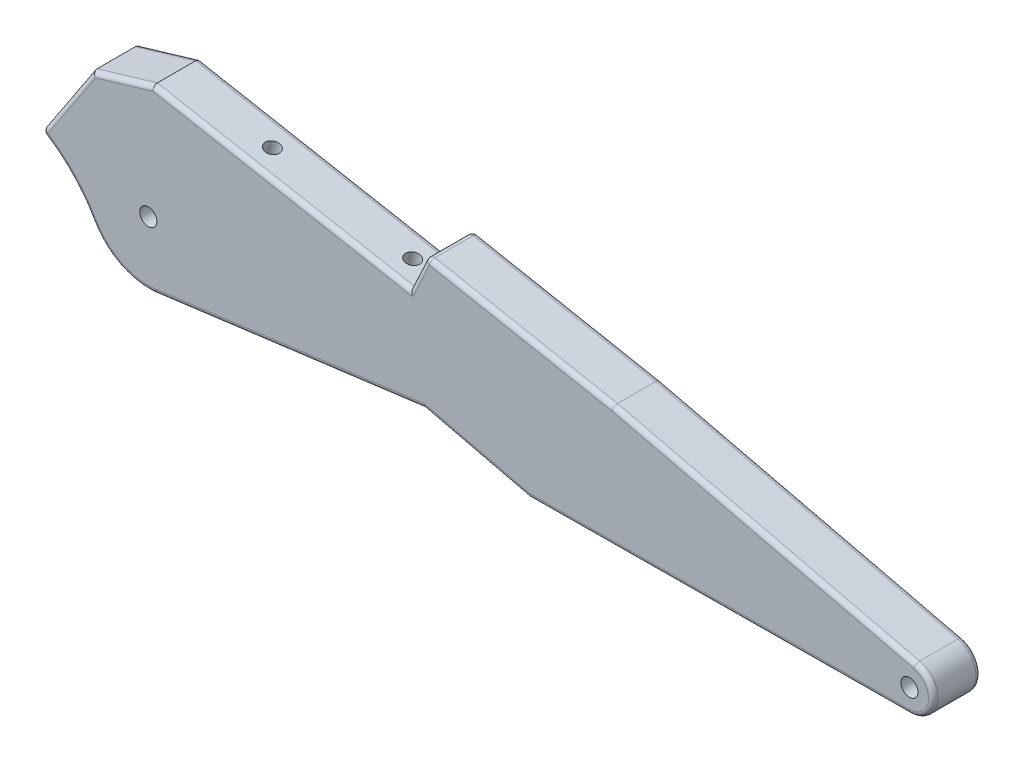
from build123d import *

# Parameters (mm, degrees)
SKETCH1_R           = 2.286
BOSS_EXTRUDE1_DEPTH = 12.7
FILLET1_R           = 1.27
SKETCH2_R           = 4.445
CUT_EXTRUDE1_DEPTH  = 3.96875
SKETCH3_R           = 1.905
CUT_EXTRUDE2_DEPTH  = 12.7
SKETCH4_R           = 1.905
CUT_EXTRUDE3_DEPTH  = 12.7


with BuildPart() as part:
    # Sketch1 → Boss-Extrude1 (new body)
    with BuildSketch(Plane.XY):
        with BuildLine():
            Line((0.048604687, -6.34981398), (-101.551395313, -7.127511762))
            Line((-101.551395313, -7.127511762), (-129.54, -0.455968887))
            Line((-129.54, -0.455968887), (-200.976985186, -9.797318323))
            ThreePointArc((-200.976985186, -9.797318323), (-210.850504728, -8.14047549), (-218.115352674, -1.251825358))
            ThreePointArc((-218.115352674, -1.251825358), (-224.036255837, 6.613973279), (-231.775, 12.7))
            Line((-231.775, 12.7), (-218.115352674, 33.3375))
            Line((-218.115352674, 33.3375), (-202.035751798, 38.1))
            Line((-202.035751798, 38.1), (-133.35, 25.4))
            Line((-133.35, 25.4), (-128.905, 34.925))
            Line((-128.905, 34.925), (-79.17262462, 25.4))
            Line((-79.17262462, 25.4), (1.47237538, 6.17694186))
            ThreePointArc((1.47237538, 6.17694186), (6.309377787, -0.717113616), (0.048604687, -6.34981398))
        make_face()
        Circle(SKETCH1_R, mode=Mode.SUBTRACT)
        with Locations((-203.2, 7.20295315)):
            Circle(SKETCH1_R, mode=Mode.SUBTRACT)
    extrude(amount=BOSS_EXTRUDE1_DEPTH)

    # Fillet1
    fillet1_edges = [part.edges().sort_by_distance(p)[0] for p in [
        (-50.751395313, -6.738662871, 0),
        (-115.545697656, -3.791740325, 0),
        (-104.03881231, 30.1625, 12.7),
        (-165.258492593, -5.126643605, 0),
        (-210.850504728, -8.14047549, 0),
        (-224.036255837, 6.613973279, 0),
        (-224.945176337, 23.01875, 0),
        (-210.075552236, 35.71875, 0),
        (-167.692875899, 31.75, 0),
        (-131.1275, 30.1625, 0),
        (-104.03881231, 30.1625, 0),
        (-38.85012462, 15.78847093, 0),
        (6.309377787, -0.717113616, 0),
        (-131.1275, 30.1625, 12.7),
        (-167.692875899, 31.75, 12.7),
        (-231.775, 12.7, 6.35),
        (-128.905, 34.925, 6.35),
        (-210.075552236, 35.71875, 12.7),
        (-224.945176337, 23.01875, 12.7),
        (-224.036255837, 6.613973279, 12.7),
        (-210.850504728, -8.14047549, 12.7),
        (-165.258492593, -5.126643605, 12.7),
        (-115.545697656, -3.791740325, 12.7),
        (-50.751395313, -6.738662871, 12.7),
        (6.309377787, -0.717113616, 12.7),
        (-38.85012462, 15.78847093, 12.7),
    ]]
    fillet(fillet1_edges, radius=FILLET1_R)

    # Sketch2 → Cut-Extrude1 (cut)
    with BuildSketch(Plane(origin=(0, 0, 0), x_dir=(-1, 0, 0), z_dir=(0, 0, -1))):
        Circle(SKETCH2_R)
    extrude(amount=-CUT_EXTRUDE1_DEPTH, mode=Mode.SUBTRACT)

    # Sketch3 → Cut-Extrude2 (cut)
    with BuildSketch(Plane(origin=(0.132942268, 0.718995244, 0), x_dir=(0.9833321660356336, -0.18181818181818188, 0), z_dir=(0.18181818181818188, 0.9833321660356336, 0))):
        with Locations(Location((-179.556061292, -6.35, 0), (0, 0, 180))):
            Circle(SKETCH3_R)
        with Locations(Location((-141.456061292, -6.35, 0), (0, 0, 180))):
            Circle(SKETCH3_R)
    extrude(amount=-CUT_EXTRUDE2_DEPTH, mode=Mode.SUBTRACT)

    # Sketch4 → Cut-Extrude3 (cut)
    with BuildSketch(Plane(origin=(-167.013671414, 110.543808611, 0), x_dir=(0, 0, 1), z_dir=(-0.8338861185572083, 0.5519365373642097, 0))):
        with Locations(Location((6.35, -110.945024644, 0), (0, 0, 270))):
            Circle(SKETCH4_R)
    extrude(amount=-CUT_EXTRUDE3_DEPTH, mode=Mode.SUBTRACT)


solid = part.part
